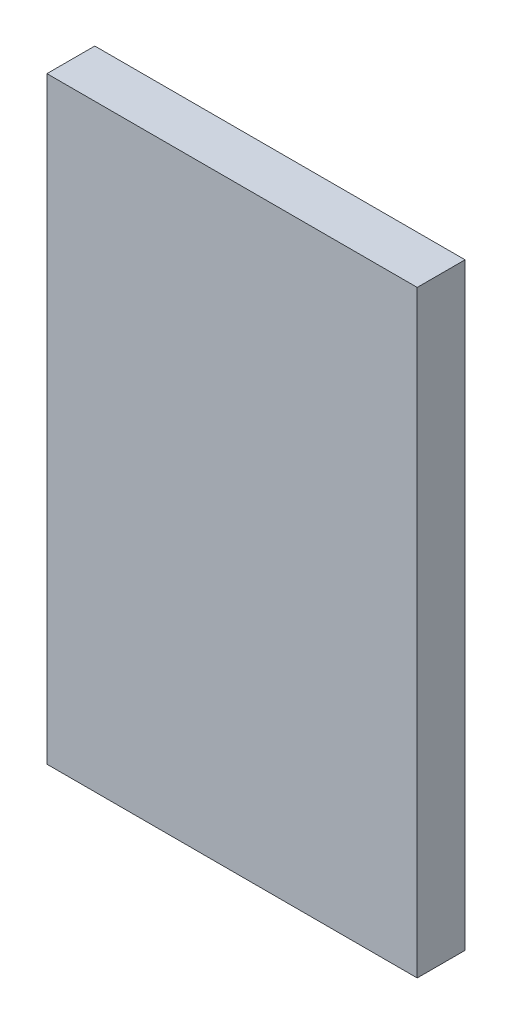
from build123d import *

# Parameters (mm, degrees)
SKETCH_1_W      = 15.478027827
SKETCH_1_H      = 25
EXTRUDE_1_DEPTH = 2


with BuildPart() as part:
    # 草图1 → 凸台-拉伸1 (new body)
    with BuildSketch(Plane.XY):
        with Locations((2.060986087, 15.95)):
            Rectangle(SKETCH_1_W, SKETCH_1_H)
    extrude(amount=EXTRUDE_1_DEPTH)


solid = part.part
